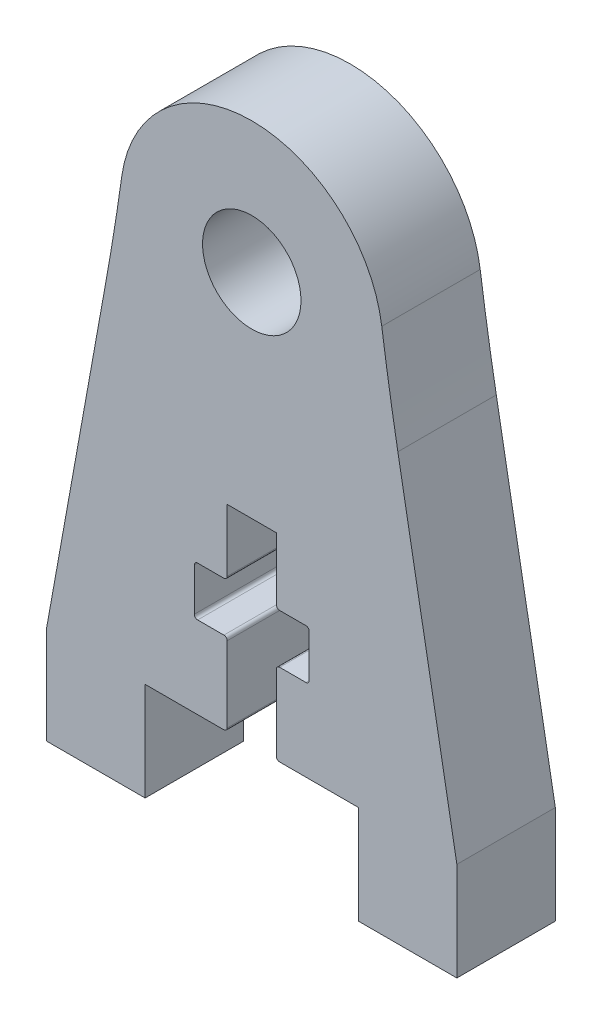
from build123d import *

# Parameters (mm, degrees)
SKETCH2_R           = 3
BOSS_EXTRUDE1_DEPTH = 6
FILLET1_R           = 160
GROOVE_DEPTH        = 42.833001327
SKETCH5_W           = 6
SKETCH5_H           = 6
FINGERS_DEPTH       = 6
FILLET2_R           = 0.2


with BuildPart() as part:
    # Sketch2 → Boss-Extrude1 (new body)
    with BuildSketch(Plane.XY):
        with BuildLine():
            Line((0, 0), (-25, 0))
            Line((-25, 0), (-20.5, 25))
            ThreePointArc((-20.5, 25), (-12.5, 33), (-4.5, 25))
            Line((-4.5, 25), (0, 0))
        make_face()
        with Locations((-12.5, 25)):
            Circle(SKETCH2_R, mode=Mode.SUBTRACT)
    extrude(amount=BOSS_EXTRUDE1_DEPTH)

    # Fillet1
    fillet1_edges = [part.edges().sort_by_distance(p)[0] for p in [
        (-20.5, 25, 3),
        (-4.5, 25, 3),
    ]]
    fillet(fillet1_edges, radius=FILLET1_R)

    # Sketch4 → Groove (cut, through all)
    with BuildSketch(Plane.XY.offset(6)):
        with BuildLine():
            Line((-14, 0), (-14, 4.8))
            ThreePointArc((-14, 4.8), (-14.058578644, 4.941421356), (-14.2, 5))
            Line((-14.2, 5), (-15.8, 5))
            ThreePointArc((-15.8, 5), (-15.941421356, 5.058578644), (-16, 5.2))
            Line((-16, 5.2), (-16, 7.8))
            ThreePointArc((-16, 7.8), (-15.941421356, 7.941421356), (-15.8, 8))
            Line((-15.8, 8), (-14.2, 8))
            ThreePointArc((-14.2, 8), (-14.058578644, 8.058578644), (-14, 8.2))
            Line((-14, 8.2), (-14, 12))
            Line((-14, 12), (-11, 12))
            Line((-11, 12), (-11, 8.2))
            ThreePointArc((-11, 8.2), (-10.941421356, 8.058578644), (-10.8, 8))
            Line((-10.8, 8), (-9.2, 8))
            ThreePointArc((-9.2, 8), (-9.058578644, 7.941421356), (-9, 7.8))
            Line((-9, 7.8), (-9, 5.2))
            ThreePointArc((-9, 5.2), (-9.058578644, 5.058578644), (-9.2, 5))
            Line((-9.2, 5), (-10.8, 5))
            ThreePointArc((-10.8, 5), (-10.941421356, 4.941421356), (-11, 4.8))
            Line((-11, 4.8), (-11, 0))
            Line((-11, 0), (-14, 0))
        make_face()
    extrude(amount=-GROOVE_DEPTH, mode=Mode.SUBTRACT)

    # Sketch5 → Fingers (add)
    with BuildSketch(Plane.XZ):
        with Locations((-22, 3)):
            Rectangle(SKETCH5_W, SKETCH5_H)
        with Locations((-3, 3)):
            Rectangle(SKETCH5_W, SKETCH5_H)
    extrude(amount=FINGERS_DEPTH)

    # Fillet2
    fillet2_edges = [part.edges().sort_by_distance(p)[0] for p in [
        (-11, 0, 3),
        (-14, 0, 3),
    ]]
    fillet(fillet2_edges, radius=FILLET2_R)


solid = part.part
